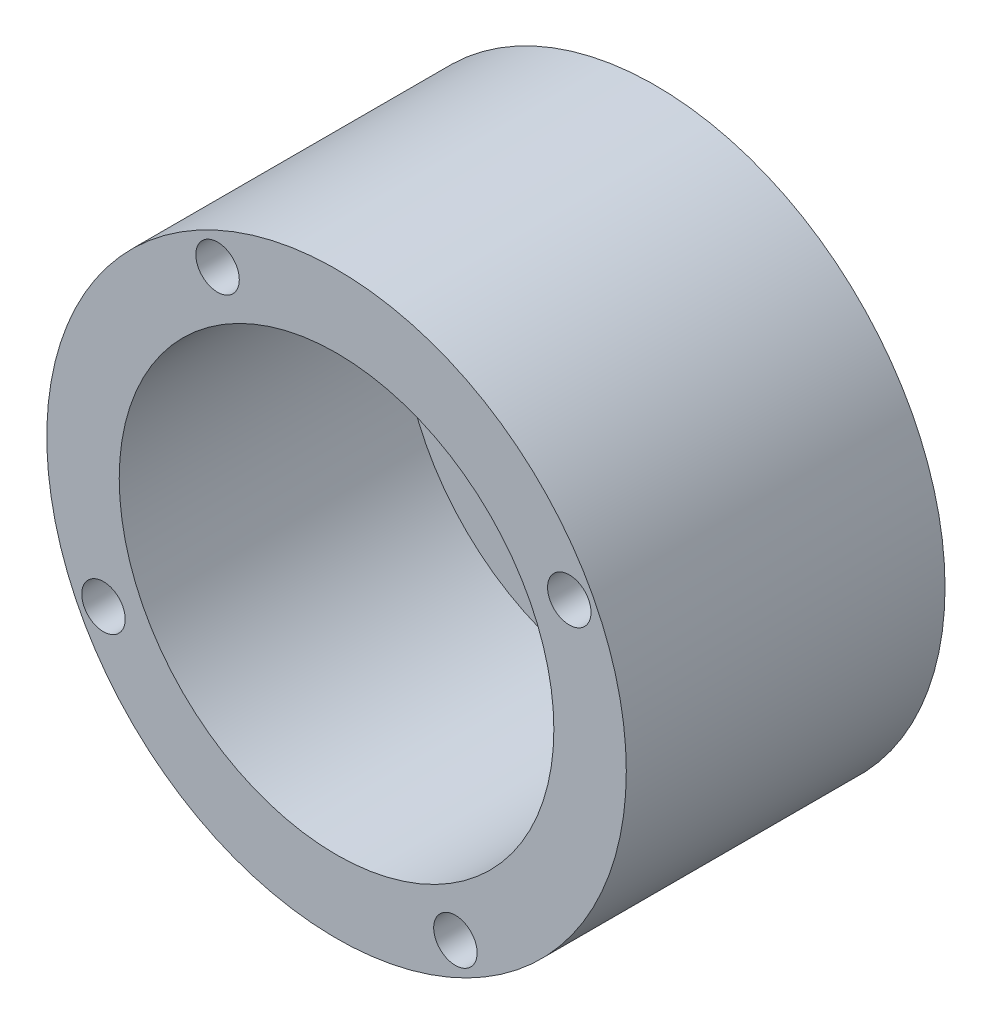
from build123d import *

# Parameters (mm, degrees)
ESQUISSE1_R             = 20
ESQUISSE1_R_2           = 15
BOSS_EXTRU_1_DEPTH      = 22
ESQUISSE5_R             = 15
BOSS_EXTRU_3_DEPTH      = 2.5
ESQUISSE12_R            = 4.25
ENL_V_MAT_EXTRU_2_DEPTH = 2.5
ESQUISSE13_R            = 1.5
ENL_V_MAT_EXTRU_3_DEPTH = 6


with BuildPart() as part:
    # Esquisse1 → Boss.-Extru.1 (new body)
    with BuildSketch(Plane.XY):
        Circle(ESQUISSE1_R)
        Circle(ESQUISSE1_R_2, mode=Mode.SUBTRACT)
    extrude(amount=BOSS_EXTRU_1_DEPTH)

    # Esquisse5 → Boss.-Extru.3 (add)
    with BuildSketch(Plane(origin=(0, 0, 0), x_dir=(-1, 0, 0), z_dir=(0, 0, -1))):
        Circle(ESQUISSE5_R)
    extrude(amount=-BOSS_EXTRU_3_DEPTH)

    # Esquisse12 → Enlèv. mat.-Extru.2 (cut)
    with BuildSketch(Plane(origin=(0, 0, 0), x_dir=(-1, 0, 0), z_dir=(0, 0, -1))):
        Circle(ESQUISSE12_R)
    extrude(amount=-ENL_V_MAT_EXTRU_2_DEPTH, mode=Mode.SUBTRACT)

    # Esquisse13 → Enlèv. mat.-Extru.3 (cut)
    with BuildSketch(Plane.XY.offset(22)):
        with Locations((16.065617012, 8.273487748)):
            Circle(ESQUISSE13_R)
        with Locations((8.204066222, -16.006302524)):
            Circle(ESQUISSE13_R)
        with Locations((-16.086643669, -8.206225502)):
            Circle(ESQUISSE13_R)
        with Locations((-8.212754961, 16.023254434)):
            Circle(ESQUISSE13_R)
    extrude(amount=-ENL_V_MAT_EXTRU_3_DEPTH, mode=Mode.SUBTRACT)


solid = part.part
